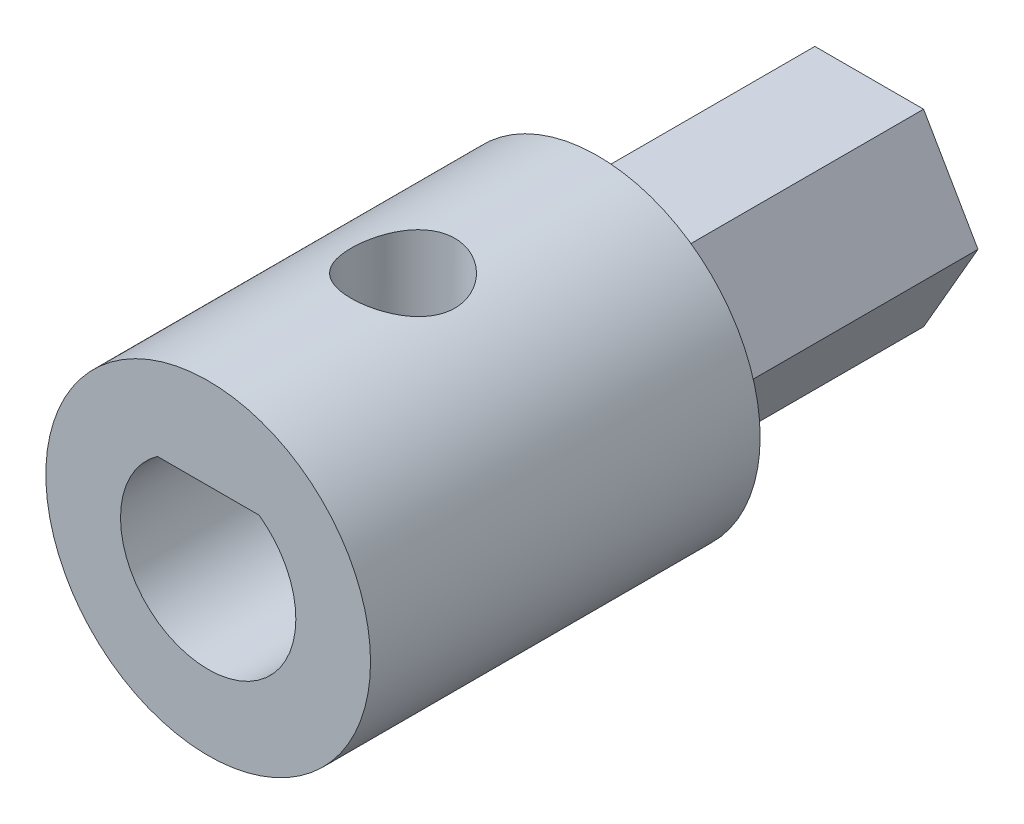
from build123d import *

# Parameters (mm, degrees)
BOSS_EXTRUDE1_DEPTH     = 8.36
SKETCH3_R               = 5
BOSS_EXTRUDE2_DEPTH     = 12
CUT_EXTRUDE2_DEPTH      = 22.552948754
CUT_EXTRUDE2_DEPTH_BACK = 22.552948754
CUT_EXTRUDE3_DEPTH      = 22.552948754
CUT_EXTRUDE3_DEPTH_BACK = 22.552948754
SKETCH5_R               = 1.6


with BuildPart() as part:
    # Sketch1 → Boss-Extrude1 (new body)
    with BuildSketch(Plane.XY):
        Polygon((-1.675, 2.901185103), (-3.35, 0), (-1.675, -2.901185103), (1.675, -2.901185103), (3.35, 0), (1.675, 2.901185103), align=None)
    extrude(amount=BOSS_EXTRUDE1_DEPTH)

    # Sketch3 → Boss-Extrude2 (add)
    with BuildSketch(Plane.XY.offset(8.36)):
        Circle(SKETCH3_R)
    extrude(amount=BOSS_EXTRUDE2_DEPTH)

    # Sketch4 → Cut-Extrude2 (cut, two sides: drawn at the far end of the back side and taken through both)
    with BuildSketch(Plane.XY.offset(20.36).offset(-CUT_EXTRUDE2_DEPTH_BACK)):
        with BuildLine():
            Line((-1.565247584, 2.2), (1.565247584, 2.2))
            ThreePointArc((1.565247584, 2.2), (0, -2.7), (-1.565247584, 2.2))
        make_face()
    extrude(amount=CUT_EXTRUDE2_DEPTH + CUT_EXTRUDE2_DEPTH_BACK, mode=Mode.SUBTRACT)

    # Sketch5 → Cut-Extrude3 (cut, two sides: drawn at the far end of the back side and taken through both)
    with BuildSketch(Plane(origin=(0, 0, 0), x_dir=(1, 0, 0), z_dir=(0, 1, 0)).offset(-CUT_EXTRUDE3_DEPTH_BACK)):
        with Locations(Location((0, -14.36, 0), (0, 0, 270))):
            Circle(SKETCH5_R)
    extrude(amount=CUT_EXTRUDE3_DEPTH + CUT_EXTRUDE3_DEPTH_BACK, mode=Mode.SUBTRACT)


solid = part.part
